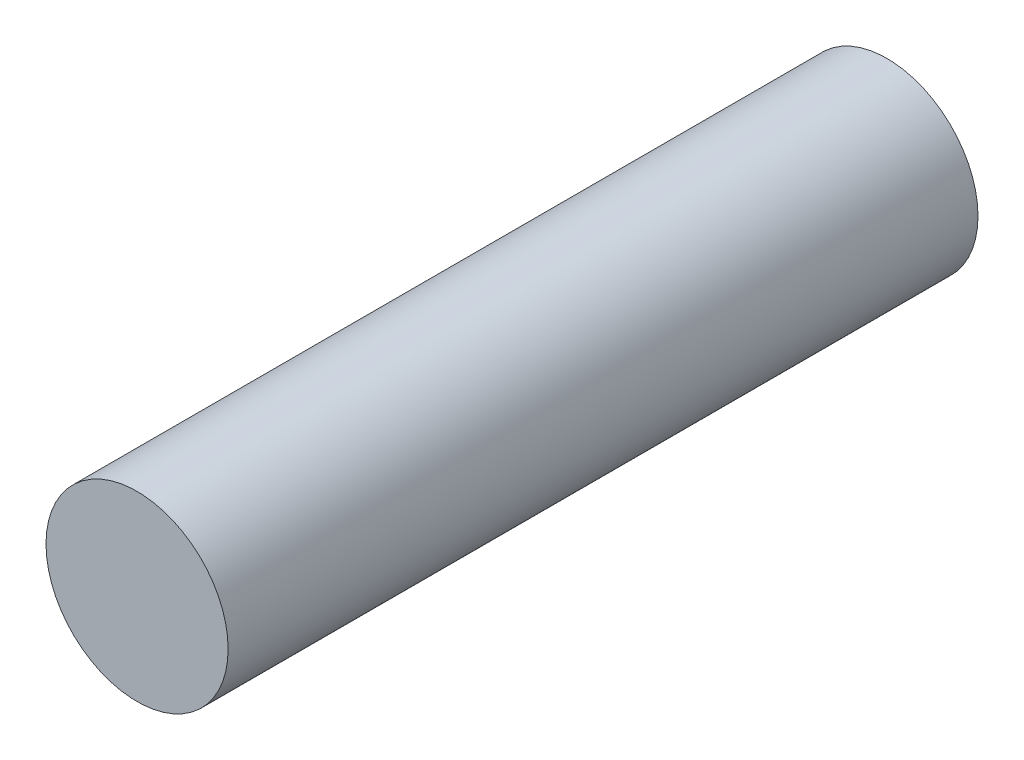
from build123d import *

# Parameters (mm, degrees)
SKETCH1_R           = 4.25
BOSS_EXTRUDE1_DEPTH = 35


with BuildPart() as part:
    # Sketch1 → Boss-Extrude1 (new body)
    with BuildSketch(Plane.XY):
        Circle(SKETCH1_R)
    extrude(amount=BOSS_EXTRUDE1_DEPTH)


solid = part.part
